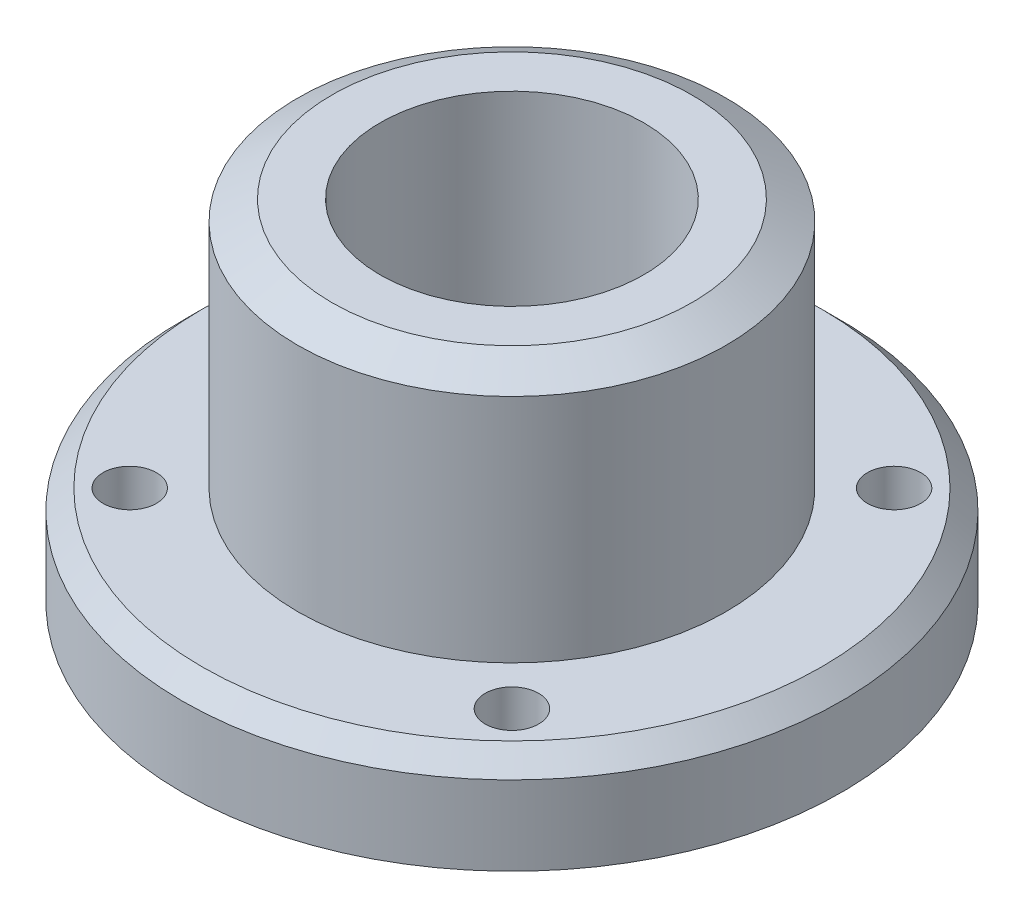
from build123d import *

# Parameters (mm, degrees)
SKETCH1_R           = 50
BOSS_EXTRUDE1_DEPTH = 15
SKETCH6_R           = 32.5
BOSS_EXTRUDE2_DEPTH = 35
SKETCH7_R           = 32.5
BOSS_EXTRUDE3_DEPTH = 3
BOSS_EXTRUDE3_TAPER = 60
SKETCH9_R           = 25.75
CUT_EXTRUDE5_DEPTH  = 10.2
SKETCH10_R          = 20
CUT_EXTRUDE6_DEPTH  = 83.654945457
SKETCH11_R          = 4.05
CUT_EXTRUDE7_DEPTH  = 40
CIRPATTERN1_COUNT   = 4
CHAMFER1_SIZE       = 3


with BuildPart() as part:
    # Sketch1 → Boss-Extrude1 (new body)
    with BuildSketch(Plane.XZ.offset(-11.5)):
        with Locations(Location((0, 0, 0), (0, 0, 90))):
            Circle(SKETCH1_R)
    extrude(amount=-BOSS_EXTRUDE1_DEPTH)

    # Sketch6 → Boss-Extrude2 (add)
    with BuildSketch(Plane(origin=(0, 26.5, 0), x_dir=(-1, 0, 0), z_dir=(0, 1, 0))):
        with Locations(Location((0, 0, 0), (0, 0, 90))):
            Circle(SKETCH6_R)
    extrude(amount=BOSS_EXTRUDE2_DEPTH)

    # Sketch7 → Boss-Extrude3 (add)
    with BuildSketch(Plane(origin=(0, 61.5, 0), x_dir=(-1, 0, 0), z_dir=(0, 1, 0))):
        with Locations(Location((0, 0, 0), (0, 0, 90))):
            Circle(SKETCH7_R)
    extrude(amount=BOSS_EXTRUDE3_DEPTH, taper=BOSS_EXTRUDE3_TAPER)

    # Sketch9 → Cut-Extrude5 (cut)
    with BuildSketch(Plane.XZ.offset(-11.5)):
        with Locations(Location((0, 0, 0), (0, 0, 90))):
            Circle(SKETCH9_R)
    extrude(amount=-CUT_EXTRUDE5_DEPTH, mode=Mode.SUBTRACT)

    # Sketch10 → Cut-Extrude6 (cut, through all)
    with BuildSketch(Plane.XZ.offset(-21.7)):
        with Locations(Location((0, 0, 0), (0, 0, 90))):
            Circle(SKETCH10_R)
    extrude(amount=-CUT_EXTRUDE6_DEPTH, mode=Mode.SUBTRACT)

    # Sketch11 → Cut-Extrude7 (cut)
    with BuildSketch(Plane(origin=(389.160069558, 11.5, 0), x_dir=(1, 0, 0), z_dir=(0, 1, 0))):
        with Locations(Location((-360.168691529, 28.991378029, 0), (0, 0, 270))):
            Circle(SKETCH11_R)
    cut_extrude7 = extrude(amount=CUT_EXTRUDE7_DEPTH, mode=Mode.SUBTRACT)

    # CirPattern1: Cut-Extrude7 ×4 about axis
    cirpattern1_axis = Axis((0, 0, 0), (0, 1, 0))
    for i in range(1, CIRPATTERN1_COUNT):
        add(cut_extrude7.rotate(cirpattern1_axis, i * 360 / CIRPATTERN1_COUNT), mode=Mode.SUBTRACT)

    # Chamfer1
    chamfer1_edges = [part.edges().sort_by_distance(p)[0] for p in [
        (0, 26.5, -50),
    ]]
    chamfer(chamfer1_edges, length=CHAMFER1_SIZE)


solid = part.part
